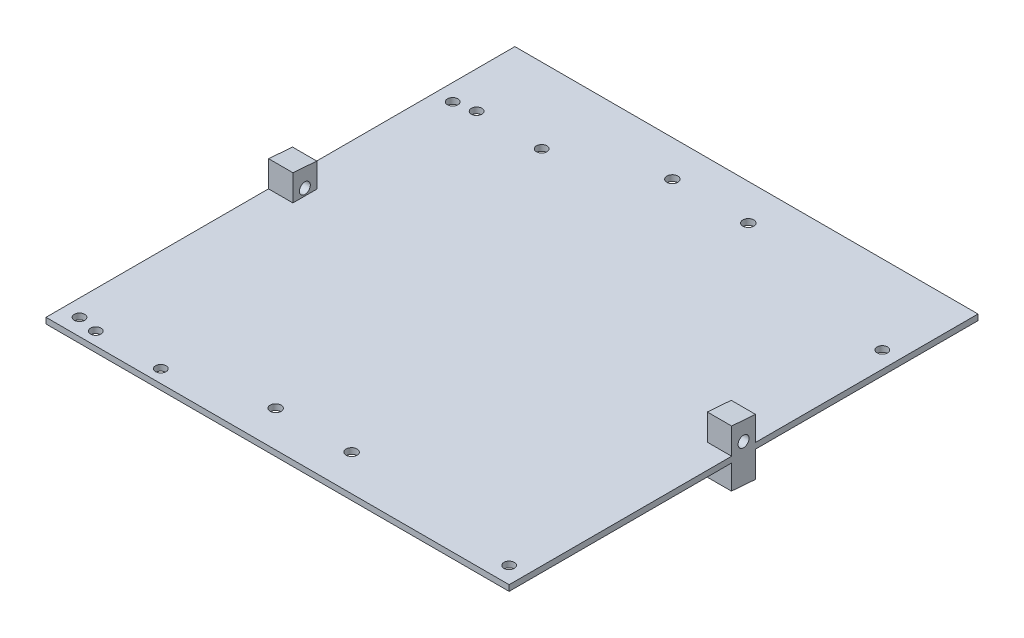
from build123d import *

# Parameters (mm, degrees)
SKETCH1_W           = 96.799999948
SKETCH1_H           = 98
BOSS_EXTRUDE1_DEPTH = 1.2192
CUT_EXTRUDE1_REACH  = 139.752
SKETCH5_R           = 1.0922
CUT_EXTRUDE2_REACH  = 139.752
SKETCH6_R           = 1.143
SKETCH10_W          = 5
SKETCH10_H          = 5.08
SKETCH10_R          = 1.143
BOSS_EXTRUDE2_DEPTH = 96.774
SKETCH13_W          = 86.614
SKETCH13_H          = 5
CUT_EXTRUDE3_DEPTH  = 5.08
BOSS_EXTRUDE3_DEPTH = 5.08
BOSS_EXTRUDE5_DEPTH = 5.08
BOSS_EXTRUDE6_DEPTH = 5.08
BOSS_EXTRUDE7_DEPTH = 5.08
BOSS_EXTRUDE8_DEPTH = 5.08


with BuildPart() as part:
    # Sketch1 → Boss-Extrude1 (new body)
    with BuildSketch(Plane(origin=(0, 0, 0), x_dir=(1, 0, 0), z_dir=(0, 1, 0))):
        with Locations((48.399999974, -49)):
            Rectangle(SKETCH1_W, SKETCH1_H)
    extrude(amount=BOSS_EXTRUDE1_DEPTH)

    # Sketch5 → Cut-Extrude1 (cut, up to next)
    with BuildSketch(Plane(origin=(0, 0, 0), x_dir=(-1, 0, 0), z_dir=(0, -1, 0)), mode=Mode.PRIVATE) as cut_extrude1_sk1:
        with Locations(Location((-3.5, -94.5, 0), (0, 0, 90))):
            Circle(SKETCH5_R)
    cut_extrude1_tool1 = extrude(cut_extrude1_sk1.sketch, amount=-CUT_EXTRUDE1_REACH, mode=Mode.PRIVATE) & part.part
    # Sketch5 → Cut-Extrude1 (cut, up to next)
    with BuildSketch(Plane(origin=(0, 0, 0), x_dir=(-1, 0, 0), z_dir=(0, -1, 0)), mode=Mode.PRIVATE) as cut_extrude1_sk2:
        with Locations(Location((-7.7, -95.3, 0), (0, 0, 90))):
            Circle(SKETCH5_R)
    cut_extrude1_tool2 = extrude(cut_extrude1_sk2.sketch, amount=-CUT_EXTRUDE1_REACH, mode=Mode.PRIVATE) & part.part
    # Sketch5 → Cut-Extrude1 (cut, up to next)
    with BuildSketch(Plane(origin=(0, 0, 0), x_dir=(-1, 0, 0), z_dir=(0, -1, 0)), mode=Mode.PRIVATE) as cut_extrude1_sk3:
        with Locations(Location((-21.3, -95.3, 0), (0, 0, 90))):
            Circle(SKETCH5_R)
    cut_extrude1_tool3 = extrude(cut_extrude1_sk3.sketch, amount=-CUT_EXTRUDE1_REACH, mode=Mode.PRIVATE) & part.part
    # Sketch5 → Cut-Extrude1 (cut, up to next)
    with BuildSketch(Plane(origin=(0, 0, 0), x_dir=(-1, 0, 0), z_dir=(0, -1, 0)), mode=Mode.PRIVATE) as cut_extrude1_sk4:
        with Locations(Location((-93.3, -94.5, 0), (0, 0, 90))):
            Circle(SKETCH5_R)
    cut_extrude1_tool4 = extrude(cut_extrude1_sk4.sketch, amount=-CUT_EXTRUDE1_REACH, mode=Mode.PRIVATE) & part.part
    # Sketch5 → Cut-Extrude1 (cut, up to next)
    with BuildSketch(Plane(origin=(0, 0, 0), x_dir=(-1, 0, 0), z_dir=(0, -1, 0)), mode=Mode.PRIVATE) as cut_extrude1_sk5:
        with Locations(Location((-93.3, -16.5, 0), (0, 0, 90))):
            Circle(SKETCH5_R)
    cut_extrude1_tool5 = extrude(cut_extrude1_sk5.sketch, amount=-CUT_EXTRUDE1_REACH, mode=Mode.PRIVATE) & part.part
    # Sketch5 → Cut-Extrude1 (cut, up to next)
    with BuildSketch(Plane(origin=(0, 0, 0), x_dir=(-1, 0, 0), z_dir=(0, -1, 0)), mode=Mode.PRIVATE) as cut_extrude1_sk6:
        with Locations(Location((-3.5, -16.5, 0), (0, 0, 90))):
            Circle(SKETCH5_R)
    cut_extrude1_tool6 = extrude(cut_extrude1_sk6.sketch, amount=-CUT_EXTRUDE1_REACH, mode=Mode.PRIVATE) & part.part
    # Sketch5 → Cut-Extrude1 (cut, up to next)
    with BuildSketch(Plane(origin=(0, 0, 0), x_dir=(-1, 0, 0), z_dir=(0, -1, 0)), mode=Mode.PRIVATE) as cut_extrude1_sk7:
        with Locations(Location((-7.7, -15.7, 0), (0, 0, 90))):
            Circle(SKETCH5_R)
    cut_extrude1_tool7 = extrude(cut_extrude1_sk7.sketch, amount=-CUT_EXTRUDE1_REACH, mode=Mode.PRIVATE) & part.part
    # Sketch5 → Cut-Extrude1 (cut, up to next)
    with BuildSketch(Plane(origin=(0, 0, 0), x_dir=(-1, 0, 0), z_dir=(0, -1, 0)), mode=Mode.PRIVATE) as cut_extrude1_sk8:
        with Locations(Location((-21.3, -15.7, 0), (0, 0, 90))):
            Circle(SKETCH5_R)
    cut_extrude1_tool8 = extrude(cut_extrude1_sk8.sketch, amount=-CUT_EXTRUDE1_REACH, mode=Mode.PRIVATE) & part.part
    add(cut_extrude1_tool1.solids().sort_by_distance((3.5, 0, 94.5))[0], mode=Mode.SUBTRACT)
    add(cut_extrude1_tool2.solids().sort_by_distance((7.7, 0, 95.3))[0], mode=Mode.SUBTRACT)
    add(cut_extrude1_tool3.solids().sort_by_distance((21.3, 0, 95.3))[0], mode=Mode.SUBTRACT)
    add(cut_extrude1_tool4.solids().sort_by_distance((93.3, 0, 94.5))[0], mode=Mode.SUBTRACT)
    add(cut_extrude1_tool5.solids().sort_by_distance((93.3, 0, 16.5))[0], mode=Mode.SUBTRACT)
    add(cut_extrude1_tool6.solids().sort_by_distance((3.5, 0, 16.5))[0], mode=Mode.SUBTRACT)
    add(cut_extrude1_tool7.solids().sort_by_distance((7.7, 0, 15.7))[0], mode=Mode.SUBTRACT)
    add(cut_extrude1_tool8.solids().sort_by_distance((21.3, 0, 15.7))[0], mode=Mode.SUBTRACT)

    # Sketch6 → Cut-Extrude2 (cut, up to next)
    with BuildSketch(Plane(origin=(0, 1.2192, 0), x_dir=(1, 0, 0), z_dir=(0, 1, 0)), mode=Mode.PRIVATE) as cut_extrude2_sk1:
        with Locations(Location((56.337499948, -7.540625, 0), (0, 0, 270))):
            Circle(SKETCH6_R)
    cut_extrude2_tool1 = extrude(cut_extrude2_sk1.sketch, amount=-CUT_EXTRUDE2_REACH, mode=Mode.PRIVATE) & part.part
    # Sketch6 → Cut-Extrude2 (cut, up to next)
    with BuildSketch(Plane(origin=(0, 1.2192, 0), x_dir=(1, 0, 0), z_dir=(0, 1, 0)), mode=Mode.PRIVATE) as cut_extrude2_sk2:
        with Locations(Location((40.462499948, -7.540625, 0), (0, 0, 270))):
            Circle(SKETCH6_R)
    cut_extrude2_tool2 = extrude(cut_extrude2_sk2.sketch, amount=-CUT_EXTRUDE2_REACH, mode=Mode.PRIVATE) & part.part
    # Sketch6 → Cut-Extrude2 (cut, up to next)
    with BuildSketch(Plane(origin=(0, 1.2192, 0), x_dir=(1, 0, 0), z_dir=(0, 1, 0)), mode=Mode.PRIVATE) as cut_extrude2_sk3:
        with Locations(Location((40.462499948, -90.459375, 0), (0, 0, 270))):
            Circle(SKETCH6_R)
    cut_extrude2_tool3 = extrude(cut_extrude2_sk3.sketch, amount=-CUT_EXTRUDE2_REACH, mode=Mode.PRIVATE) & part.part
    # Sketch6 → Cut-Extrude2 (cut, up to next)
    with BuildSketch(Plane(origin=(0, 1.2192, 0), x_dir=(1, 0, 0), z_dir=(0, 1, 0)), mode=Mode.PRIVATE) as cut_extrude2_sk4:
        with Locations(Location((56.337499948, -90.459375, 0), (0, 0, 270))):
            Circle(SKETCH6_R)
    cut_extrude2_tool4 = extrude(cut_extrude2_sk4.sketch, amount=-CUT_EXTRUDE2_REACH, mode=Mode.PRIVATE) & part.part
    add(cut_extrude2_tool1.solids().sort_by_distance((56.3375, 1.2192, 7.540625))[0], mode=Mode.SUBTRACT)
    add(cut_extrude2_tool2.solids().sort_by_distance((40.4625, 1.2192, 7.540625))[0], mode=Mode.SUBTRACT)
    add(cut_extrude2_tool3.solids().sort_by_distance((40.4625, 1.2192, 90.459375))[0], mode=Mode.SUBTRACT)
    add(cut_extrude2_tool4.solids().sort_by_distance((56.3375, 1.2192, 90.459375))[0], mode=Mode.SUBTRACT)

    # Sketch10 → Boss-Extrude2 (add)
    with BuildSketch(Plane(origin=(96.799999948, 0, 0), x_dir=(0, 0, -1), z_dir=(1, 0, 0))):
        with Locations((-49, 3.7592)):
            Rectangle(SKETCH10_W, SKETCH10_H)
        with Locations((-49, 2.64795)):
            Circle(SKETCH10_R, mode=Mode.SUBTRACT)
    extrude(amount=-BOSS_EXTRUDE2_DEPTH)

    # Sketch13 → Cut-Extrude3 (cut)
    with BuildSketch(Plane(origin=(0, 6.2992, 0), x_dir=(1, 0, 0), z_dir=(0, 1, 0))):
        with Locations((48.412999948, -49)):
            Rectangle(SKETCH13_W, SKETCH13_H)
    extrude(amount=-CUT_EXTRUDE3_DEPTH, mode=Mode.SUBTRACT)

    # Sketch14 → Boss-Extrude3 (add)
    with BuildSketch(Plane.XZ):
        Polygon((0, 49), (0, 51.54), (5.08, 51.54), (5.08, 46.46), (0, 46.46), align=None)
        Polygon((96.799999948, 49), (96.799999948, 51.54), (91.719999948, 51.54), (91.719999948, 46.46), (96.799999948, 46.46), align=None)
    extrude(amount=BOSS_EXTRUDE3_DEPTH)

    # Sketch15 → Boss-Extrude5 (add)
    with BuildSketch(Plane.ZY):
        Polygon((51.54, -5.08), (46.46, -5.08), (46.46, -5.479804671), align=None)
    extrude(amount=-BOSS_EXTRUDE5_DEPTH)

    # Sketch16 → Boss-Extrude6 (add)
    with BuildSketch(Plane(origin=(96.799999948, 0, 0), x_dir=(0, 0, -1), z_dir=(1, 0, 0))):
        Polygon((-46.46, -5.08), (-51.54, -5.08), (-46.46, -5.479804671), align=None)
    extrude(amount=-BOSS_EXTRUDE6_DEPTH)

    # Sketch17 → Boss-Extrude7 (add)
    with BuildSketch(Plane(origin=(96.799999948, 0, 0), x_dir=(0, 0, -1), z_dir=(1, 0, 0))):
        Polygon((-46.5, 6.2992), (-51.5, 6.2992), (-51.5, 6.692708534), align=None)
    extrude(amount=-BOSS_EXTRUDE7_DEPTH)

    # Sketch18 → Boss-Extrude8 (add)
    with BuildSketch(Plane.ZY.offset(-0.025999948)):
        Polygon((46.5, 6.2992), (51.5, 6.2992), (51.5, 6.692708534), align=None)
    extrude(amount=-BOSS_EXTRUDE8_DEPTH)


solid = part.part
